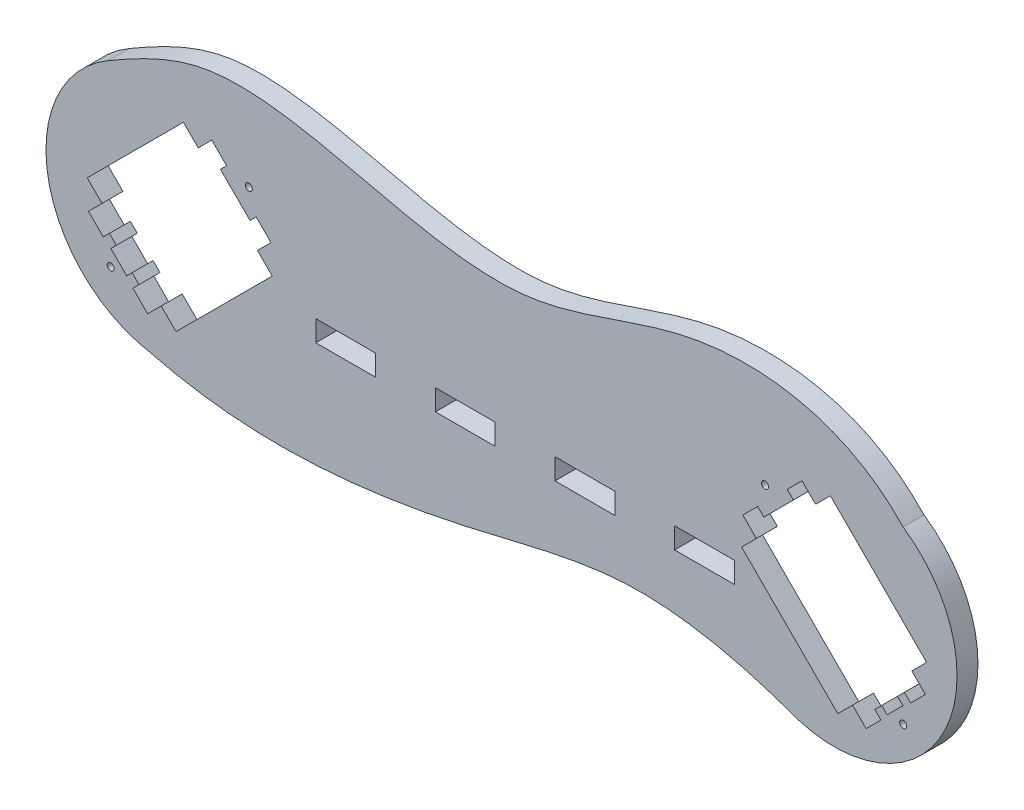
from build123d import *

# Parameters (mm, degrees)
AUFSATZ_LINEAR_AUSTRAGEN1_DEPTH = 3
SCHNITT_LINEAR_AUSTRAGEN2_DEPTH = 71.820715528
F_1_0_1_DURCHMESSER_BOHRUNG1_D  = 1
SKIZZE6_W                       = 8.571428571
SKIZZE6_H                       = 3
SKIZZE6_W_2                     = 8.571428572
SCHNITT_LINEAR_AUSTRAGEN3_DEPTH = 10
SCHNITT_LINEAR_AUSTRAGEN4_DEPTH = 10


with BuildPart() as part:
    # Skizze1 → Aufsatz-Linear austragen1 (new body)
    with BuildSketch(Plane.XY):
        with BuildLine():
            ThreePointArc((39.09381812, -17.677272974), (61.320070719, -9.707081363), (55.674936462, 13.220254247))
            add(Edge.make_bspline(
                [(55.674936462, 13.220254247), (47.609471596, 21.818170185), (26.779512273, 24.965996748), (-4.819250153, 8.3879963), (-36.143165112, 25.515706185), (-52.998162401, 17.21531918), (-58.269375127, 14.13647811)],
                knots=[0, 0, 0, 0, 0.281767128, 0.483095288, 0.871800147, 1, 1, 1, 1], degree=3))
            ThreePointArc((-58.269375127, 14.13647811), (-66.8837152, -4.574474742), (-52.252246026, -19.073672007))
            add(Edge.make_bspline(
                [(39.09381812, -17.677272974), (32.211724331, -15.261258593), (16.874059684, -11.708986477), (-13.13089401, -20.340470931), (-36.840562428, -23.058241539), (-52.252246026, -19.073672007)],
                knots=[0, 0, 0, 0, 0.240412868, 0.489927657, 1, 1, 1, 1], degree=3))
        make_face()
        Polygon((49.501476789, -13.570033348), (33.591574213, 2.339869229), (42.076855587, 10.825150603), (57.986758164, -5.084751973), align=None, mode=Mode.SUBTRACT)
        Polygon((-51.712310601, -13.570033348), (-35.802408025, 2.339869229), (-44.287689399, 10.825150603), (-60.197591975, -5.084751973), align=None, mode=Mode.SUBTRACT)
    extrude(amount=AUFSATZ_LINEAR_AUSTRAGEN1_DEPTH)

    # Skizze3 → Schnitt-Linear austragen2 (cut, through all)
    with BuildSketch(Plane.XY.offset(3)):
        Polygon((-47.469669914, 11.885810775), (-61.258252147, -1.902771458), (-59.136931804, -4.024091802), (-61.081475452, -5.96863545), (-58.960155108, -8.089955793), (-58.076271632, -7.206072317), (-53.833630945, -11.448713004), (-54.717514421, -12.332596481), (-52.596194078, -14.453916824), (-50.651650429, -12.509373176), (-48.530330086, -14.630693519), (-34.741747853, -0.842111286), (-36.863068196, 1.279209057), (-34.918524548, 3.223752706), (-37.039844892, 5.345073049), (-37.923728368, 4.461189573), (-42.166369055, 8.70383026), (-41.282485579, 9.587713736), (-43.403805922, 11.70903408), (-45.348349571, 9.764490432), align=None)
        Polygon((59.047418335, -1.902771458), (45.258836102, 11.885810775), (43.137515759, 9.764490432), (41.19297211, 11.70903408), (39.071651767, 9.587713736), (39.955535243, 8.70383026), (35.712894556, 4.461189573), (34.82901108, 5.345073049), (32.707690736, 3.223752706), (34.652234384, 1.279209057), (32.530914041, -0.842111286), (46.319496274, -14.630693519), (48.440816618, -12.509373176), (50.385360266, -14.453916824), (52.506680609, -12.332596481), (51.622797133, -11.448713004), (55.86543782, -7.206072317), (56.749321296, -8.089955793), (58.87064164, -5.96863545), (56.926097992, -4.024091802), align=None)
    extrude(amount=-SCHNITT_LINEAR_AUSTRAGEN2_DEPTH, mode=Mode.SUBTRACT)

    # Ø1.0 (1) Durchmesser Bohrung1 (through all)
    with Locations(Plane.XY.offset(3)):
        with Locations((-38.100505063, 8.527053564), (-57.899494937, -11.271936309), (35.889671251, 8.527053564), (55.688661125, -11.271936309)):
            Hole(F_1_0_1_DURCHMESSER_BOHRUNG1_D / 2)

    # Skizze6 → Schnitt-Linear austragen3 (cut)
    with BuildSketch(Plane(origin=(0, 0, 0), x_dir=(-1, 0, 0), z_dir=(0, 0, -1))):
        with Locations((-27.215326594, -4.5)):
            Rectangle(SKIZZE6_W, SKIZZE6_H)
        with Locations((-10.072469451, -4.5)):
            Rectangle(SKIZZE6_W, SKIZZE6_H)
        with Locations((7.070387692, -4.5)):
            Rectangle(SKIZZE6_W, SKIZZE6_H)
        with Locations((24.213244835, -4.5)):
            Rectangle(SKIZZE6_W_2, SKIZZE6_H)
    extrude(amount=-SCHNITT_LINEAR_AUSTRAGEN3_DEPTH, mode=Mode.SUBTRACT)

    # Skizze7 → Schnitt-Linear austragen4 (cut)
    with BuildSketch(Plane.XY.offset(3)):
        Polygon((-57.086322138, -8.196021811), (-54.823580438, -10.45876351), (-55.601397898, -11.23658097), (-57.864139598, -8.97383927), align=None)
        Polygon((52.612746627, -10.45876351), (54.875488326, -8.196021811), (55.653305786, -8.97383927), (53.390564086, -11.23658097), align=None)
    extrude(amount=-SCHNITT_LINEAR_AUSTRAGEN4_DEPTH, mode=Mode.SUBTRACT)


solid = part.part
